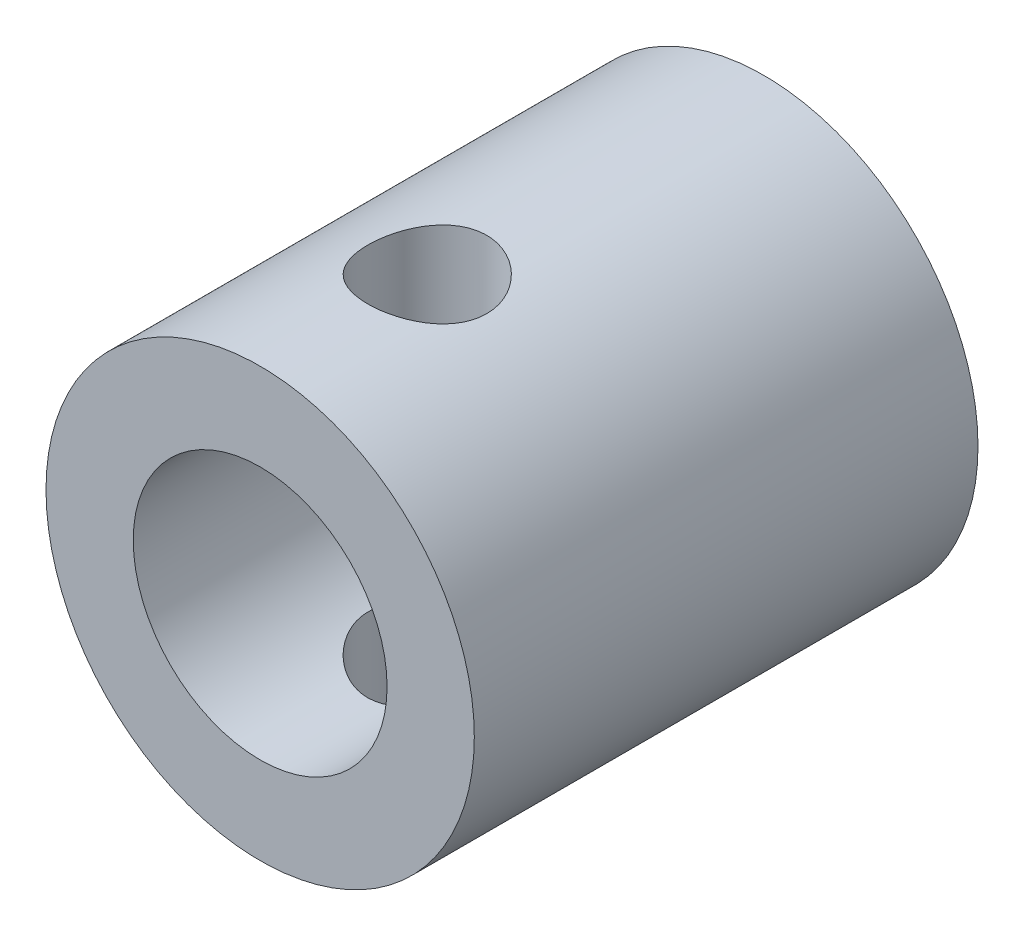
from build123d import *

# Parameters (mm, degrees)
SKETCH1_R           = 5.4
BOSS_EXTRUDE1_DEPTH = 12.7
SKETCH3_R           = 1.5
CUT_EXTRUDE2_DEPTH  = 12.7
SKETCH5_R           = 2.25
CUT_EXTRUDE3_DEPTH  = 3.5
SKETCH4_R           = 3.2
CUT_EXTRUDE4_DEPTH  = 9.2


with BuildPart() as part:
    # Sketch1 → Boss-Extrude1 (new body)
    with BuildSketch(Plane.XY):
        Circle(SKETCH1_R)
    extrude(amount=BOSS_EXTRUDE1_DEPTH)

    # Sketch3 → Cut-Extrude2 (cut)
    with BuildSketch(Plane(origin=(0, 5.4, 0), x_dir=(1, 0, 0), z_dir=(0, 1, 0))):
        with Locations(Location((0, -8.486582987, 0), (0, 0, 270))):
            Circle(SKETCH3_R)
    extrude(amount=-CUT_EXTRUDE2_DEPTH, mode=Mode.SUBTRACT)

    # Sketch5 → Cut-Extrude3 (cut)
    with BuildSketch(Plane(origin=(0, 0, 0), x_dir=(-1, 0, 0), z_dir=(0, 0, -1))):
        Circle(SKETCH5_R)
    extrude(amount=-CUT_EXTRUDE3_DEPTH, mode=Mode.SUBTRACT)

    # Sketch4 → Cut-Extrude4 (cut)
    with BuildSketch(Plane.XY.offset(12.7)):
        Circle(SKETCH4_R)
    extrude(amount=-CUT_EXTRUDE4_DEPTH, mode=Mode.SUBTRACT)


solid = part.part
